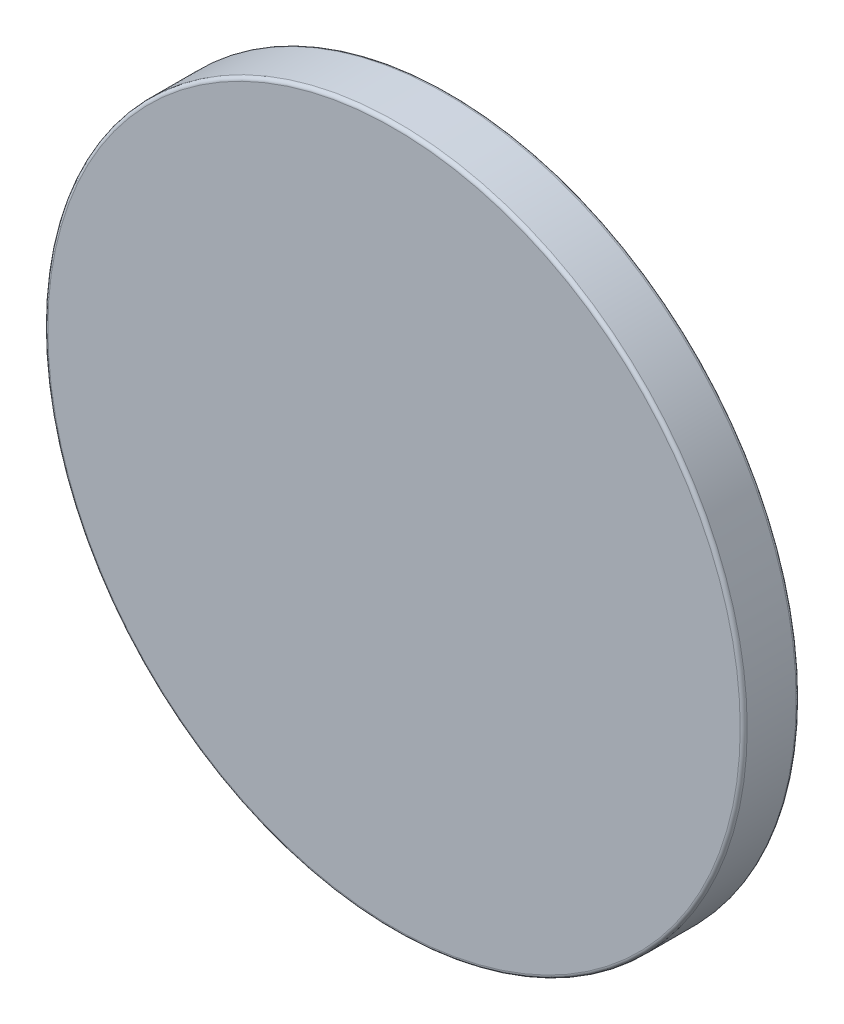
from build123d import *

# Parameters (mm, degrees)
BOSS_EXTRUDE1_DEPTH      = 1.016
BOSS_EXTRUDE1_DEPTH_BACK = 1.016
SKETCH3_R                = 12.7
FILLET1_R                = 0.127


with BuildPart() as part:
    # Sketch3 → Boss-Extrude1 (new, two sides: drawn at the far end of the back side and taken through both)
    with BuildSketch(Plane.XY.offset(-BOSS_EXTRUDE1_DEPTH_BACK)):
        Circle(SKETCH3_R)
    extrude(amount=BOSS_EXTRUDE1_DEPTH + BOSS_EXTRUDE1_DEPTH_BACK)

    # Fillet1
    fillet1_edges = [part.edges().sort_by_distance(p)[0] for p in [
        (-12.7, 0, -1.016),
        (-12.7, 0, 1.016),
    ]]
    fillet(fillet1_edges, radius=FILLET1_R)


solid = part.part
